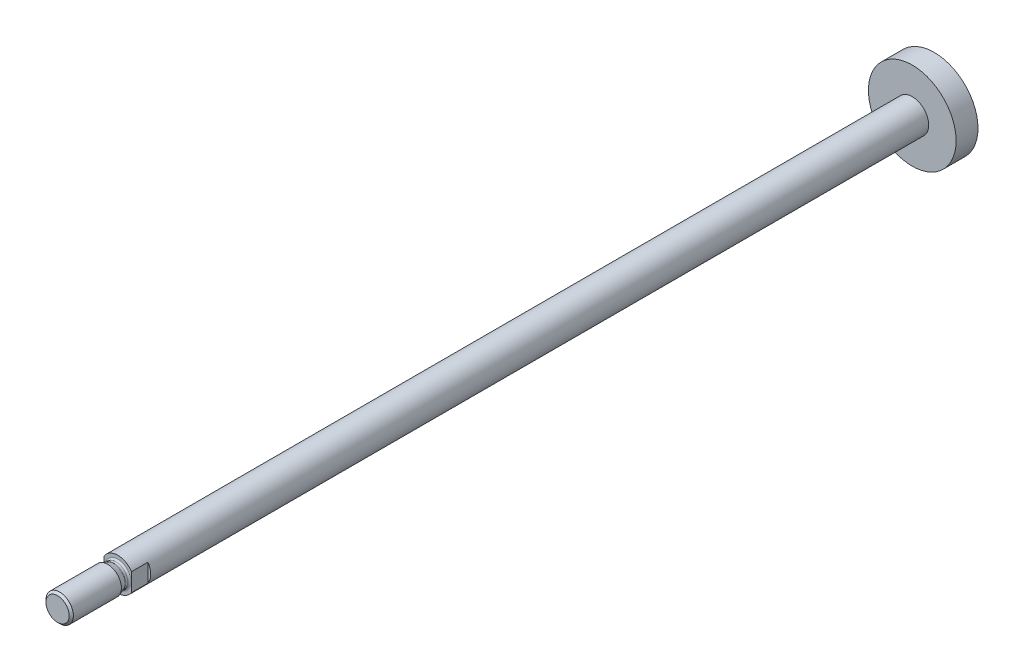
from build123d import *

# Parameters (mm, degrees)
CUT_EXTRUDE1_DEPTH = 7


with BuildPart() as part:
    # Sketch1 → Revolve1 (revolve)
    with BuildSketch(Plane(origin=(0, 0, 0), x_dir=(0, 0, -1), z_dir=(1, 0, 0))):
        Polygon((-8, 0), (-8, 6), (282, 6), (282, 16), (290, 16), (290, 0), align=None)
    revolve(axis=Axis((0, 0, -290), (0, 0, 1)))

    # Sketch2 → Revolve2 (revolve)
    with BuildSketch(Plane(origin=(0, 0, 0), x_dir=(0, 0, -1), z_dir=(1, 0, 0))):
        with BuildLine():
            Line((-30, 0), (-30, 4.233))
            Line((-30, 4.233), (-29.233, 5))
            Line((-29.233, 5), (-11.697981936, 5))
            Line((-11.697981936, 5), (-9.599415898, 4.236184428))
            ThreePointArc((-9.599415898, 4.236184428), (-9.498392718, 4.209115348), (-9.394203812, 4.2))
            Line((-9.394203812, 4.2), (-8.6, 4.2))
            ThreePointArc((-8.6, 4.2), (-8.175735931, 4.375735931), (-8, 4.8))
            Line((-8, 4.8), (-8, 5))
            Line((-8, 5), (-7, 5))
            Line((-7, 5), (-7, 0))
            Line((-7, 0), (-30, 0))
        make_face()
    revolve(axis=Axis((0, 0, 7), (0, 0, 1)))

    # Sketch3 → Cut-Extrude1 (cut)
    with BuildSketch(Plane.XY.offset(2)):
        Polygon((-10, 20), (-10, -10), (-5, -10), (-5, 10), (5, 10), (5, -10), (10, -10), (10, 20), align=None)
    extrude(amount=CUT_EXTRUDE1_DEPTH, mode=Mode.SUBTRACT)


solid = part.part
